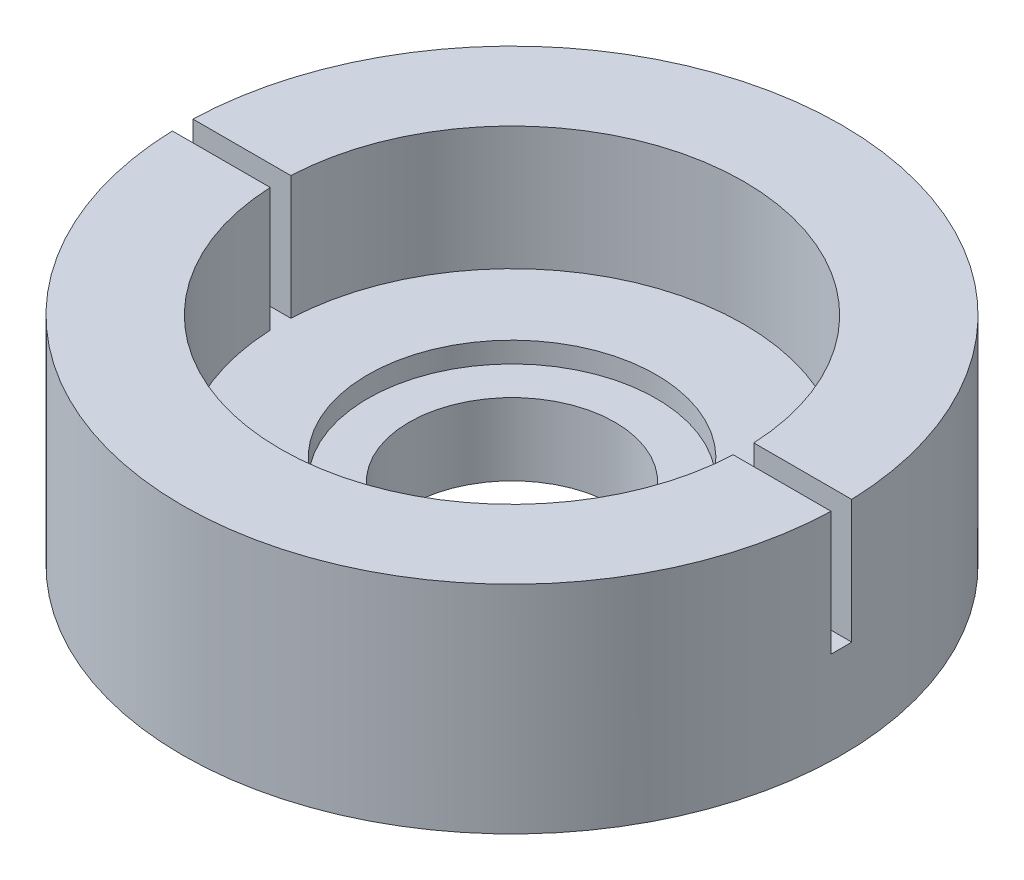
from build123d import *

# Parameters (mm, degrees)
SKETCH1_R           = 16
SKETCH1_R_2         = 5
SKETCH1_R_3         = 1.975
BOSS_EXTRUDE1_DEPTH = 3.5
SKETCH2_R           = 16
BOSS_EXTRUDE2_DEPTH = 1
SKETCH3_R           = 16
SKETCH3_R_2         = 11.25
BOSS_EXTRUDE3_DEPTH = 6
SKETCH4_W           = 32
SKETCH4_H           = 1
CUT_EXTRUDE1_DEPTH  = 6
SKETCH5_R           = 7
CUT_EXTRUDE2_DEPTH  = 1


with BuildPart() as part:
    # Sketch1 → Boss-Extrude1 (new body)
    with BuildSketch(Plane(origin=(0, 0, 0), x_dir=(1, 0, 0), z_dir=(0, 1, 0))):
        with Locations(Location((0, 0, 0), (0, 0, 270))):
            Circle(SKETCH1_R)
        with Locations(Location((0, 0, 0), (0, 0, 270))):
            Circle(SKETCH1_R_2, mode=Mode.SUBTRACT)
        with Locations(Location((0, 12.5, 0), (0, 0, 270))):
            Circle(SKETCH1_R_3, mode=Mode.SUBTRACT)
        with Locations(Location((12.5, 0, 0), (0, 0, 270))):
            Circle(SKETCH1_R_3, mode=Mode.SUBTRACT)
        with Locations(Location((0, -12.5, 0), (0, 0, 270))):
            Circle(SKETCH1_R_3, mode=Mode.SUBTRACT)
        with Locations(Location((-12.5, 0, 0), (0, 0, 270))):
            Circle(SKETCH1_R_3, mode=Mode.SUBTRACT)
    extrude(amount=BOSS_EXTRUDE1_DEPTH)

    # Sketch2 → Boss-Extrude2 (add)
    with BuildSketch(Plane(origin=(0, 3.5, 0), x_dir=(1, 0, 0), z_dir=(0, 1, 0))):
        with Locations(Location((0, 0, 0), (0, 0, 270))):
            Circle(SKETCH2_R)
    extrude(amount=BOSS_EXTRUDE2_DEPTH)

    # Sketch3 → Boss-Extrude3 (add)
    with BuildSketch(Plane(origin=(0, 4.5, 0), x_dir=(1, 0, 0), z_dir=(0, 1, 0))):
        with Locations(Location((0, 0, 0), (0, 0, 270))):
            Circle(SKETCH3_R)
        with Locations(Location((0, 0, 0), (0, 0, 270))):
            Circle(SKETCH3_R_2, mode=Mode.SUBTRACT)
    extrude(amount=BOSS_EXTRUDE3_DEPTH)

    # Sketch4 → Cut-Extrude1 (cut)
    with BuildSketch(Plane(origin=(0, 10.5, 0), x_dir=(1, 0, 0), z_dir=(0, 1, 0))):
        Rectangle(SKETCH4_W, SKETCH4_H)
    extrude(amount=-CUT_EXTRUDE1_DEPTH, mode=Mode.SUBTRACT)

    # Sketch5 → Cut-Extrude2 (cut)
    with BuildSketch(Plane(origin=(0, 4.5, 0), x_dir=(1, 0, 0), z_dir=(0, 1, 0))):
        with Locations(Location((0, 0, 0), (0, 0, 270))):
            Circle(SKETCH5_R)
    extrude(amount=-CUT_EXTRUDE2_DEPTH, mode=Mode.SUBTRACT)


solid = part.part
